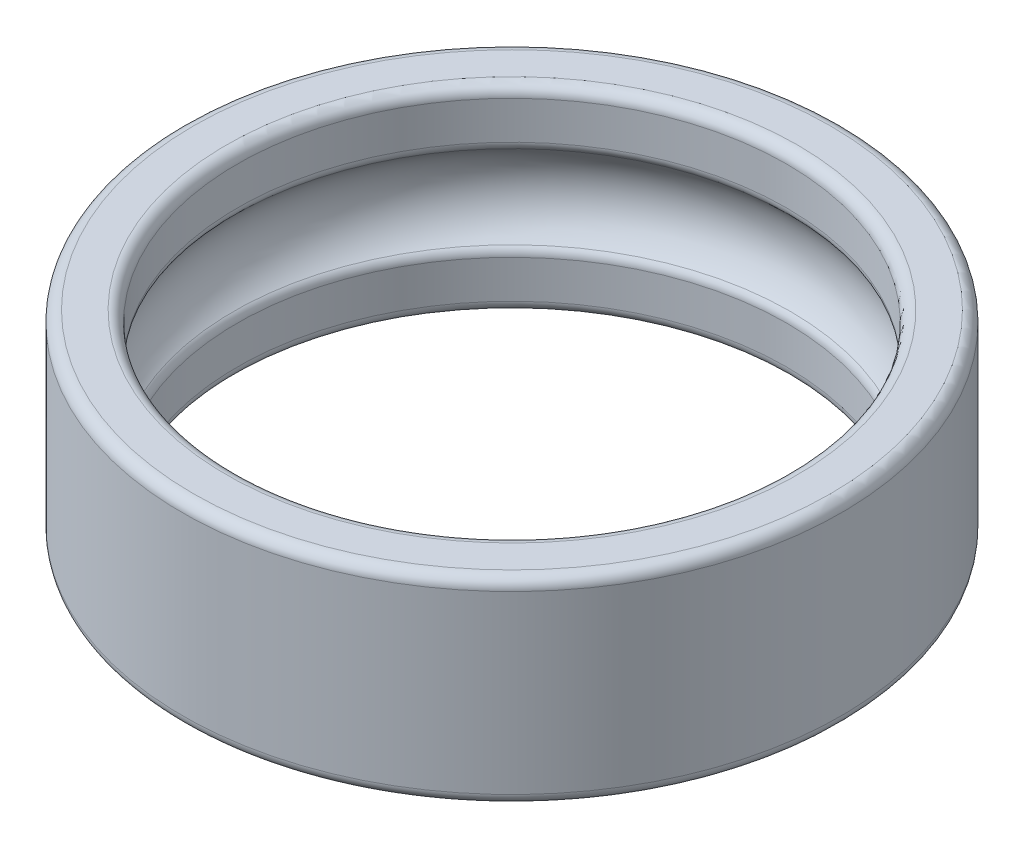
from build123d import *


with BuildPart() as part:
    # Sketch1 → Revolve1 (revolve)
    with BuildSketch(Plane(origin=(0, 0, 0), x_dir=(0, 0, -1), z_dir=(1, 0, 0))):
        with BuildLine():
            Line((25, -8), (25, -4.538997687))
            ThreePointArc((25, -4.538997687), (25.088639197, -4.127389271), (25.338842975, -3.788750135))
            ThreePointArc((25.338842975, -3.788750135), (27.05, 0), (25.338842975, 3.788750135))
            ThreePointArc((25.338842975, 3.788750135), (25.088639197, 4.127389271), (25, 4.538997687))
            Line((25, 4.538997687), (25, 8))
            ThreePointArc((25, 8), (25.292893219, 8.707106781), (26, 9))
            Line((26, 9), (29, 9))
            ThreePointArc((29, 9), (29.707106781, 8.707106781), (30, 8))
            Line((30, 8), (30, -8))
            ThreePointArc((30, -8), (29.707106781, -8.707106781), (29, -9))
            Line((29, -9), (26, -9))
            ThreePointArc((26, -9), (25.292893219, -8.707106781), (25, -8))
        make_face()
    revolve(axis=Axis((0, 0, 0), (0, 1, 0)))


solid = part.part
